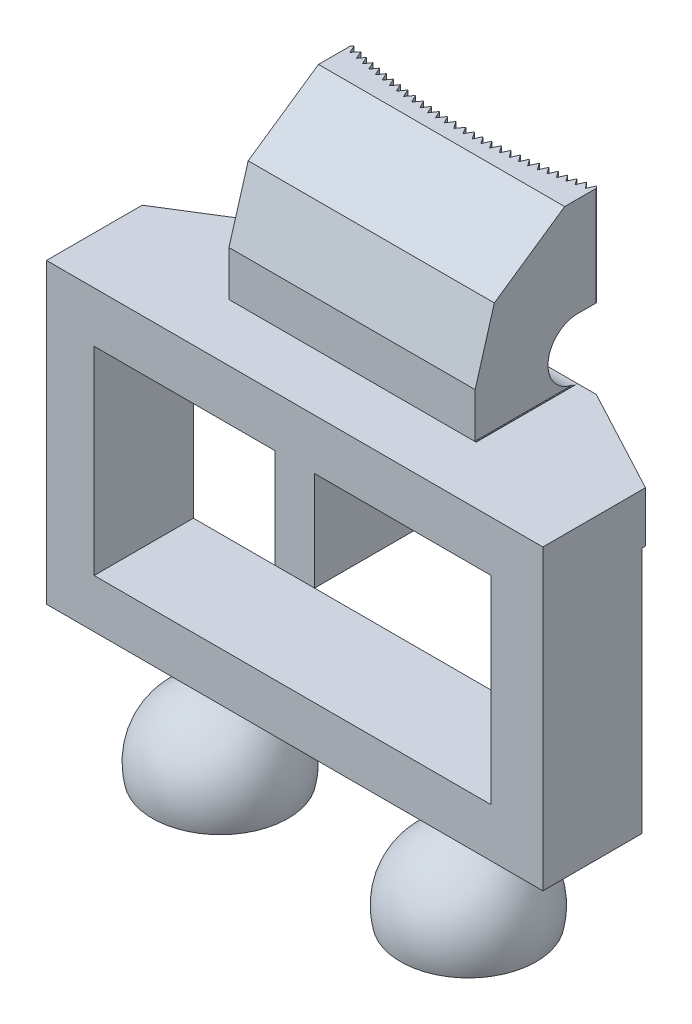
from build123d import *

# Parameters (mm, degrees)
SKETCH1_W            = 25
SKETCH1_H            = 15
SKETCH1_W_2          = 20
SKETCH1_H_2          = 10
BOSS_EXTRUDE1_DEPTH  = 5
SKETCH2_R            = 0.5
BOSS_EXTRUDE2_DEPTH  = 2
SKETCH5_W            = 2
SKETCH5_H            = 5
BOSS_EXTRUDE3_DEPTH  = 5
SKETCH9_W            = 25
SKETCH9_H            = 3
BOSS_EXTRUDE6_DEPTH  = 2.5458
BOSS_EXTRUDE11_DEPTH = 25
BOSS_EXTRUDE12_DEPTH = 5
SKETCH13_W           = 15.672382287
SKETCH13_H           = 8.611187453
CUT_EXTRUDE2_DEPTH   = 6.3
SKETCH14_W           = 15.973777952
SKETCH14_H           = 8.468711573
CUT_EXTRUDE4_DEPTH   = 6.3
SKETCH17_W           = 5.109908143
SKETCH17_H           = 0.020831831
CUT_EXTRUDE6_DEPTH   = 6.25
CUT_EXTRUDE9_DEPTH   = 2.75


with BuildPart() as part:
    # Sketch1 → Boss-Extrude1 (new body)
    with BuildSketch(Plane.XY):
        with Locations((10.101524963, 5.045869423)):
            Rectangle(SKETCH1_W, SKETCH1_H)
        with Locations((10, 5)):
            Rectangle(SKETCH1_W_2, SKETCH1_H_2, mode=Mode.SUBTRACT)
    extrude(amount=BOSS_EXTRUDE1_DEPTH)

    # Sketch2 → Boss-Extrude2 (add)
    with BuildSketch(Plane.XZ.offset(2.454130577)):
        with Locations(Location((16.351524963, 2.5, 0), (0, 0, 90))):
            Circle(SKETCH2_R)
        with Locations(Location((3.851524963, 2.5, 0), (0, 0, 90))):
            Circle(SKETCH2_R)
    extrude(amount=BOSS_EXTRUDE2_DEPTH)

    # Sketch4 → Revolve1 (revolve)
    with BuildSketch(Plane.ZY.offset(-3.851524963)):
        with BuildLine():
            Line((2.5, -4.454130577), (2.5, -3.954130577))
            ThreePointArc((2.5, -3.954130577), (-0.231202032, -5.265401389), (-0.915920918, -8.216681744))
            Line((-0.915920918, -8.216681744), (-0.431201702, -8.092923646))
            ThreePointArc((-0.431201702, -8.092923646), (0.163723132, -5.572160759), (2.5, -4.454130577))
        make_face()
    revolve1 = revolve(axis=Axis((3.851524963, -4.454130577, 2.5), (0, 1, 0)))

    # Mirror1: Revolve1 across plane
    add(revolve1.mirror(Plane.ZY.offset(-10.101524963)))

    # Sketch5 → Boss-Extrude3 (add)
    with BuildSketch(Plane.XZ.offset(-10)):
        with Locations((10.101524963, 2.5)):
            Rectangle(SKETCH5_W, SKETCH5_H)
    extrude(amount=BOSS_EXTRUDE3_DEPTH)

    # Sketch9 → Boss-Extrude6 (add)
    with BuildSketch(Plane(origin=(0, 12.545869423, 0), x_dir=(1, 0, 0), z_dir=(0, 1, 0))):
        with Locations((10.101524963, 1.5)):
            Rectangle(SKETCH9_W, SKETCH9_H)
    extrude(amount=-BOSS_EXTRUDE6_DEPTH)

    # Sketch10 → Boss-Extrude11 (add)
    with BuildSketch(Plane.ZY.offset(2.398475037)):
        with BuildLine():
            Line((-3, 20.545869423), (-3, 15.545869423))
            ThreePointArc((-3, 15.545869423), (-1.560121709, 14.045869423), (-3, 12.545869423))
            Line((-3, 12.545869423), (2.109908143, 12.545869423))
            Line((2.109908143, 12.545869423), (2.109908143, 14.812382809))
            Line((2.109908143, 14.812382809), (1.14185951, 18.112167841))
            Line((1.14185951, 18.112167841), (-2.398491653, 20.545869423))
            Line((-2.398491653, 20.545869423), (-3, 20.545869423))
        make_face()
    extrude(amount=-BOSS_EXTRUDE11_DEPTH)

    # Sketch11 → Boss-Extrude12 (add)
    with BuildSketch(Plane(origin=(0, 20.545869423, 0), x_dir=(1, 0, 0), z_dir=(0, 1, 0))):
        Polygon((22.601524963, 6.370034263), (22.218498761, 6.583454581), (22.206504106, 6.145147118), (21.839800975, 6.36430085), (21.839800975, 5.944815365), (21.470908859, 6.165277305), (21.470908859, 5.751252067), (21.090285371, 5.978725057), (21.090285371, 5.559686479), (20.715009404, 5.783963617), (20.715009404, 5.37871548), (20.340220839, 5.60270133), (20.340220839, 5.205623066), (19.969772082, 5.427015305), (19.969772082, 5.041871154), (19.609473543, 5.257197293), (19.609473543, 4.889453606), (19.240036756, 5.110241059), (19.204018954, 4.725841041), (18.84343083, 4.941340245), (18.809044063, 4.574347447), (18.482899309, 4.833590643), (18.434301365, 4.437674053), (18.099284993, 4.703969045), (18.029565103, 4.297643206), (17.685889029, 4.570821549), (17.636576293, 4.169081713), (17.36430182, 4.468570031), (17.241504215, 4.047072227), (16.949921416, 4.338518658), (16.830217977, 3.927641452), (16.56189014, 4.222788666), (16.445356586, 3.82279196), (16.205334691, 4.102534079), (16.03541914, 3.718356506), (15.784012514, 4.011367368), (15.609927315, 3.617762258), (15.397544049, 3.917976793), (15.227764955, 3.53410775), (15.005332386, 3.848527484), (14.830770329, 3.453844203), (14.601445444, 3.778006576), (14.424838392, 3.378699578), (14.190795155, 3.709531583), (14.01395843, 3.309705298), (13.77195079, 3.65179539), (13.592594218, 3.246271753), (13.353481935, 3.584269111), (13.179653394, 3.191244304), (12.937387652, 3.533699238), (12.7645906, 3.143006617), (12.501662523, 3.493899949), (12.3122286, 3.098460835), (12.055758175, 3.454101418), (11.859127953, 3.062190893), (11.619872014, 3.416106336), (11.44208312, 3.03616005), (11.201398975, 3.392188142), (11.025924275, 3.017187439), (10.777585982, 3.384537806), (10.557631993, 3.017187439), (10.355137202, 3.367185629), (10.101524963, 3.017187439), (9.847912725, 3.367185629), (9.61814049, 3.017187439), (9.425463944, 3.384537806), (9.177125651, 3.017187439), (9.001650951, 3.392188142), (8.760966807, 3.03616005), (8.583177912, 3.416106336), (8.343921973, 3.062190893), (8.147291751, 3.454101418), (7.890821326, 3.098460835), (7.701387404, 3.493899949), (7.438459327, 3.143006617), (7.265662275, 3.533699238), (7.023396532, 3.191244304), (6.849567992, 3.584269111), (6.610455709, 3.246271753), (6.431099137, 3.65179539), (6.189091497, 3.309705298), (6.012254772, 3.709531583), (5.778211534, 3.378699578), (5.601604482, 3.778006576), (5.372279597, 3.453844203), (5.19771754, 3.848527484), (4.975284972, 3.53410775), (4.805505878, 3.917976793), (4.593122611, 3.617762258), (4.419037412, 4.011367368), (4.167630787, 3.718356506), (3.997715235, 4.102534079), (3.757693341, 3.82279196), (3.641159786, 4.222788666), (3.37283195, 3.927641452), (3.253128511, 4.338518658), (2.961545711, 4.047072227), (2.838748106, 4.468570031), (2.566473633, 4.169081713), (2.517160897, 4.570821549), (2.173484824, 4.297643206), (2.103764933, 4.703969045), (1.768748562, 4.437674053), (1.720150617, 4.833590643), (1.394005864, 4.574347447), (1.359619096, 4.941340245), (0.999030973, 4.725841041), (0.96301317, 5.110241059), (0.593576383, 4.889453606), (0.593576383, 5.257197293), (0.233277844, 5.041871154), (0.233277844, 5.427015305), (-0.137170912, 5.205623066), (-0.137170912, 5.60270133), (-0.511959477, 5.37871548), (-0.511959477, 5.783963617), (-0.887235445, 5.559686479), (-0.887235445, 5.978725057), (-1.267858932, 5.751252067), (-1.267858932, 6.165277305), (-1.636751048, 5.944815365), (-1.636751048, 6.36430085), (-2.00345418, 6.145147118), (-2.015448835, 6.583454581), (-2.398475037, 6.370034263), (-2.398475037, 3), (22.601524963, 3), align=None)
    extrude(amount=-BOSS_EXTRUDE12_DEPTH)

    # Sketch13 → Cut-Extrude2 (cut)
    with BuildSketch(Plane.ZY.offset(2.398475037)):
        with Locations((0.217053265, 16.85146315)):
            Rectangle(SKETCH13_W, SKETCH13_H)
    extrude(amount=-CUT_EXTRUDE2_DEPTH, mode=Mode.SUBTRACT)

    # Sketch14 → Cut-Extrude4 (cut)
    with BuildSketch(Plane(origin=(22.601524963, 0, 0), x_dir=(0, 0, -1), z_dir=(1, 0, 0))):
        with Locations((-0.130094813, 16.801057041)):
            Rectangle(SKETCH14_W, SKETCH14_H)
    extrude(amount=-CUT_EXTRUDE4_DEPTH, mode=Mode.SUBTRACT)

    # Sketch17 → Cut-Extrude6 (cut)
    with BuildSketch(Plane(origin=(22.601524963, 0, 0), x_dir=(0, 0, -1), z_dir=(1, 0, 0))):
        with Locations((0.445045928, 12.556285339)):
            Rectangle(SKETCH17_W, SKETCH17_H)
    extrude(amount=-CUT_EXTRUDE6_DEPTH, mode=Mode.SUBTRACT)

    # Sketch21 → Cut-Extrude9 (cut)
    with BuildSketch(Plane(origin=(0, 12.545869423, 0), x_dir=(1, 0, 0), z_dir=(0, 1, 0))):
        Polygon((-2.398475037, -0.181001123), (-2.398475037, 3), (2.705080675, 3), align=None)
        Polygon((17.294919325, 3), (22.601524963, 3), (22.601524963, 0.170691666), align=None)
    extrude(amount=-CUT_EXTRUDE9_DEPTH, mode=Mode.SUBTRACT)


solid = part.part
